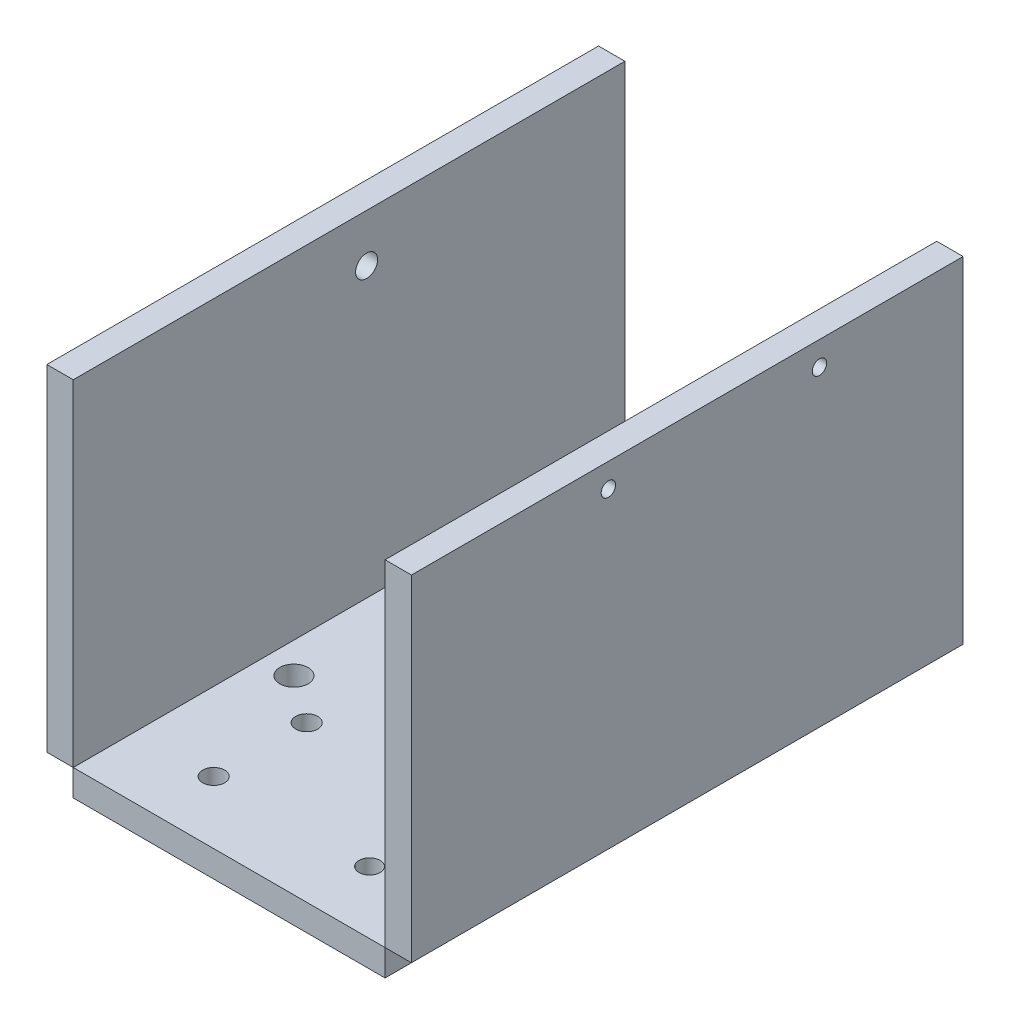
from build123d import *

# Parameters (mm, degrees)
CROQUIS1_W              = 65
CROQUIS1_H              = 115
CROQUIS1_R              = 2.3
CROQUIS1_R_2            = 2.2
SALIENTE_EXTRUIR1_DEPTH = 5.5
CROQUIS2_W              = 115
CROQUIS2_H              = 70
SALIENTE_EXTRUIR2_DEPTH = 5.5
CROQUIS3_W              = 115
CROQUIS3_H              = 70
SALIENTE_EXTRUIR3_DEPTH = 5.5
CROQUIS4_R              = 3.117146835
CROQUIS4_R_2            = 2.957808417
CORTAR_EXTRUIR1_DEPTH   = 5.5
CROQUIS5_R              = 2.3
CORTAR_EXTRUIR2_DEPTH   = 5.5
CROQUIS6_R              = 1.626960879
CORTAR_EXTRUIR3_DEPTH   = 5.5
CROQUIS7_R              = 1.5
CORTAR_EXTRUIR4_DEPTH   = 5.5


with BuildPart() as part:
    # Croquis1 → Saliente-Extruir1 (new body)
    with BuildSketch(Plane(origin=(0, 0, 0), x_dir=(1, 0, 0), z_dir=(0, 1, 0))):
        with Locations((32.5, -57.5)):
            Rectangle(CROQUIS1_W, CROQUIS1_H)
        with Locations(Location((16.25, -6.22808869, 0), (0, 0, 270))):
            Circle(CROQUIS1_R, mode=Mode.SUBTRACT)
        with Locations(Location((48.75, -6.22808869, 0), (0, 0, 270))):
            Circle(CROQUIS1_R, mode=Mode.SUBTRACT)
        with Locations(Location((48.75, -18.68426607, 0), (0, 0, 90))):
            Circle(CROQUIS1_R, mode=Mode.SUBTRACT)
        with Locations(Location((16.25, -18.68426607, 0), (0, 0, 90))):
            Circle(CROQUIS1_R, mode=Mode.SUBTRACT)
        with Locations(Location((16.25, -82.587524247, 0), (0, 0, 270))):
            Circle(CROQUIS1_R, mode=Mode.SUBTRACT)
        with Locations(Location((48.75, -82.587524247, 0), (0, 0, 270))):
            Circle(CROQUIS1_R_2, mode=Mode.SUBTRACT)
        with Locations(Location((48.75, -101.976725706, 0), (0, 0, 90))):
            Circle(CROQUIS1_R_2, mode=Mode.SUBTRACT)
        with Locations(Location((16.25, -101.976725706, 0), (0, 0, 90))):
            Circle(CROQUIS1_R, mode=Mode.SUBTRACT)
    extrude(amount=SALIENTE_EXTRUIR1_DEPTH)

    # Croquis4 → Cortar-Extruir1 (cut)
    with BuildSketch(Plane(origin=(0, 5.5, 0), x_dir=(1, 0, 0), z_dir=(0, 1, 0))):
        with Locations(Location((55.638593898, -75.420943833, 0), (0, 0, 270))):
            Circle(CROQUIS4_R)
        with Locations(Location((6.419577958, -75.420943833, 0), (0, 0, 270))):
            Circle(CROQUIS4_R_2)
    extrude(amount=-CORTAR_EXTRUIR1_DEPTH, mode=Mode.SUBTRACT)

    # Croquis6 → Cortar-Extruir3 (cut)
    with BuildSketch(Plane(origin=(0, 5.5, 0), x_dir=(1, 0, 0), z_dir=(0, 1, 0))):
        with Locations(Location((24.264689506, -3.572552561, 0), (0, 0, 270))):
            Circle(CROQUIS6_R)
        with Locations(Location((30.764689506, -3.572552561, 0), (0, 0, 270))):
            Circle(CROQUIS6_R)
        with Locations(Location((37.264689506, -3.572552561, 0), (0, 0, 270))):
            Circle(CROQUIS6_R)
    extrude(amount=-CORTAR_EXTRUIR3_DEPTH, mode=Mode.SUBTRACT)


with BuildPart() as body_2:
    # Croquis2 → Saliente-Extruir2 (new body)
    with BuildSketch(Plane.ZY):
        with Locations((57.5, 40.5)):
            Rectangle(CROQUIS2_W, CROQUIS2_H)
    extrude(amount=SALIENTE_EXTRUIR2_DEPTH)

    # Croquis5 → Cortar-Extruir2 (cut)
    with BuildSketch(Plane.ZY.offset(5.5)):
        with Locations((53.849390676, 65.5)):
            Circle(CROQUIS5_R)
    extrude(amount=-CORTAR_EXTRUIR2_DEPTH, mode=Mode.SUBTRACT)


with BuildPart() as body_3:
    # Croquis3 → Saliente-Extruir3 (new body)
    with BuildSketch(Plane(origin=(65, 0, 0), x_dir=(0, 0, -1), z_dir=(1, 0, 0))):
        with Locations((-57.5, 40.5)):
            Rectangle(CROQUIS3_W, CROQUIS3_H)
    extrude(amount=SALIENTE_EXTRUIR3_DEPTH)

    # Croquis7 → Cortar-Extruir4 (cut)
    with BuildSketch(Plane.ZY.offset(-65)):
        with Locations((29.950463966, 70.5)):
            Circle(CROQUIS7_R)
        with Locations((73.950463966, 70.5)):
            Circle(CROQUIS7_R)
    extrude(amount=-CORTAR_EXTRUIR4_DEPTH, mode=Mode.SUBTRACT)


solid = Compound([part.part, body_2.part, body_3.part])
